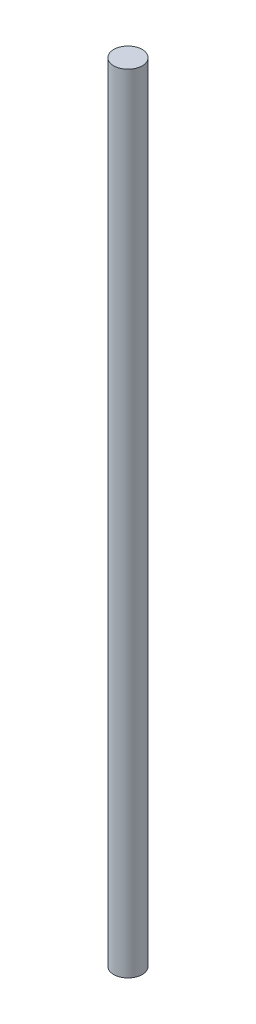
from build123d import *

# Parameters (mm, degrees)
SKETCH1_R           = 1.5
BOSS_EXTRUDE1_DEPTH = 41.5


with BuildPart() as part:
    # Sketch1 → Boss-Extrude1 (new, symmetric)
    with BuildSketch(Plane(origin=(0, 0, 0), x_dir=(1, 0, 0), z_dir=(0, 1, 0))):
        with Locations(Location((0, 0, 0), (0, 0, 270))):
            Circle(SKETCH1_R)
    extrude(amount=BOSS_EXTRUDE1_DEPTH, both=True)


solid = part.part
